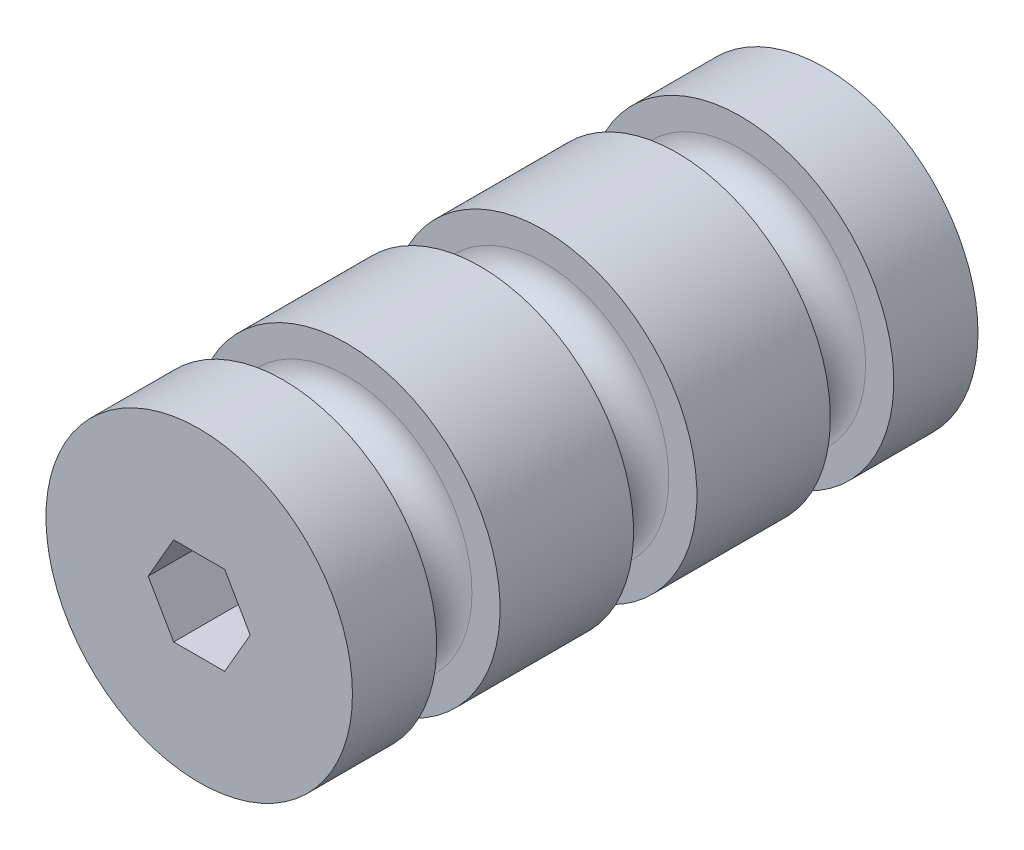
from build123d import *

# Parameters (mm, degrees)
SKETCH1_R           = 23.33625
BOSS_EXTRUDE1_DEPTH = 95.25


with BuildPart() as part:
    # Sketch1 → Boss-Extrude1 (new body)
    with BuildSketch(Plane.XY):
        Circle(SKETCH1_R)
        Polygon((-3.886144662, 6.731), (3.886144662, 6.731), (7.772289324, 0), (3.886144662, -6.731), (-3.886144662, -6.731), (-7.772289324, 0), align=None, mode=Mode.SUBTRACT)
    extrude(amount=BOSS_EXTRUDE1_DEPTH)

    # Sketch2 → Cut-Revolve1 (revolve, cut)
    with BuildSketch(Plane(origin=(0, 0, 0), x_dir=(0, 0, -1), z_dir=(1, 0, 0))):
        with BuildLine():
            Line((-82.423, 23.33625), (-72.771, 23.33625))
            Line((-72.771, 23.33625), (-72.771, 19.05))
            ThreePointArc((-72.771, 19.05), (-77.597, 14.224), (-82.423, 19.05))
            Line((-82.423, 19.05), (-82.423, 23.33625))
        make_face()
        with BuildLine():
            Line((-52.451, 19.05), (-52.451, 23.33625))
            Line((-52.451, 23.33625), (-42.799, 23.33625))
            Line((-42.799, 23.33625), (-42.799, 19.05))
            ThreePointArc((-42.799, 19.05), (-47.625, 14.224), (-52.451, 19.05))
        make_face()
        with BuildLine():
            Line((-22.479, 19.05), (-22.479, 23.33625))
            Line((-22.479, 23.33625), (-12.827, 23.33625))
            Line((-12.827, 23.33625), (-12.827, 19.05))
            ThreePointArc((-12.827, 19.05), (-17.653, 14.224), (-22.479, 19.05))
        make_face()
    revolve(axis=Axis((0, 0, 0), (0, 0, 1)), mode=Mode.SUBTRACT)


solid = part.part
